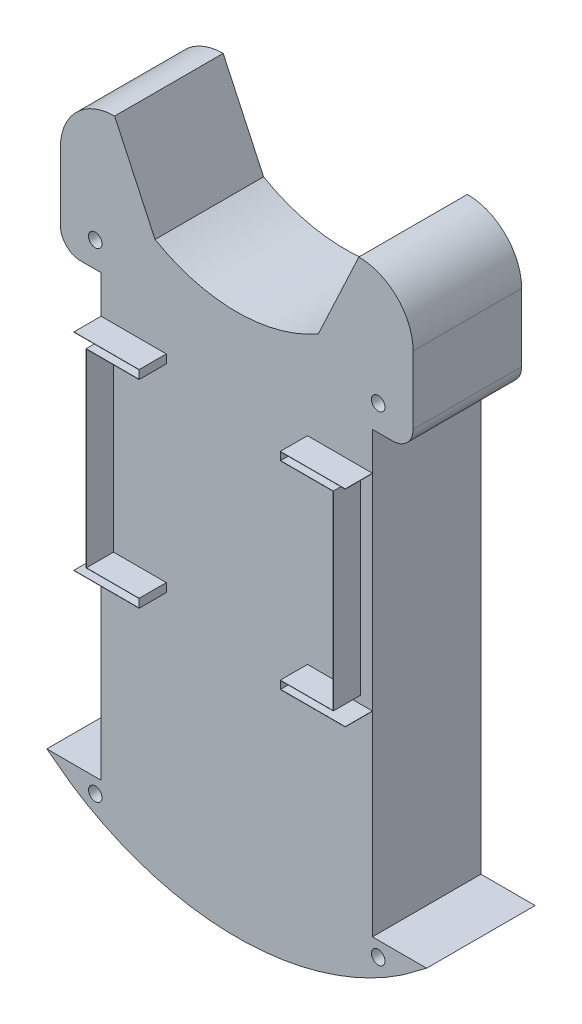
from build123d import *

# Parameters (mm, degrees)
BOSS_EXTRUDE1_DEPTH = 1016
EXTRUDE_THIN1_DEPTH = 254
SKETCH6_R           = 63.5
CUT_EXTRUDE1_DEPTH  = 2032


with BuildPart() as part:
    # Sketch2 → Boss-Extrude1 (new body)
    with BuildSketch(Plane.XY):
        with BuildLine():
            Line((1270, -2155.261469057), (1270, 1959.538530943))
            Line((1270, 1959.538530943), (1460.5, 1959.538530943))
            ThreePointArc((1460.5, 1959.538530943), (1595.203841816, 2015.334689127), (1651, 2150.038530943))
            Line((1651, 2150.038530943), (1651, 2785.038530943))
            ThreePointArc((1651, 2785.038530943), (1502.210244843, 3144.248775786), (1143, 3293.038530943))
            Line((1143, 3293.038530943), (764.60873935, 2481.57585382))
            ThreePointArc((764.60873935, 2481.57585382), (0, 2275.888971296), (-764.60873935, 2481.57585382))
            Line((-764.60873935, 2481.57585382), (-1143, 3293.038530943))
            ThreePointArc((-1143, 3293.038530943), (-1502.210244843, 3144.248775786), (-1651, 2785.038530943))
            Line((-1651, 2785.038530943), (-1651, 2150.038530943))
            ThreePointArc((-1651, 2150.038530943), (-1595.203841816, 2015.334689127), (-1460.5, 1959.538530943))
            Line((-1460.5, 1959.538530943), (-1270, 1959.538530943))
            Line((-1270, 1959.538530943), (-1270, -2155.261469057))
            Line((-1270, -2155.261469057), (-1778, -2155.261469057))
            Line((-1778, -2155.261469057), (-1548.565234395, -2325.592766333))
            ThreePointArc((-1548.565234395, -2325.592766333), (0, -2794), (1548.565234395, -2325.592766333))
            Line((1548.565234395, -2325.592766333), (1778, -2155.261469057))
            Line((1778, -2155.261469057), (1270, -2155.261469057))
        make_face()
    extrude(amount=BOSS_EXTRUDE1_DEPTH)

    # Sketch5 → Extrude-Thin1 (add)
    with BuildSketch(Plane.XY.offset(1016)):
        Polygon((1270, -326.461469057), (662.125525201, -326.461469057), (662.125525201, -250.261469057), (1155.7, -250.261469057), (1155.7, 1527.738530943), (662.125525201, 1527.738530943), (662.125525201, 1603.938530943), (1270, 1603.938530943), (1270, 1601.398530943), (664.665525201, 1601.398530943), (664.665525201, 1530.278530943), (1158.24, 1530.278530943), (1158.24, -252.801469057), (664.665525201, -252.801469057), (664.665525201, -323.921469057), (1270, -323.921469057), align=None)
        Polygon((-1270, -326.461469057), (-662.125525201, -326.461469057), (-662.125525201, -250.261469057), (-1155.7, -250.261469057), (-1155.7, 1527.738530943), (-662.125525201, 1527.738530943), (-662.125525201, 1603.938530943), (-1270, 1603.938530943), (-1270, 1606.478530943), (-659.585525201, 1606.478530943), (-659.585525201, 1525.198530943), (-1153.16, 1525.198530943), (-1153.16, -247.721469057), (-659.585525201, -247.721469057), (-659.585525201, -329.001469057), (-1270, -329.001469057), align=None)
    extrude(amount=EXTRUDE_THIN1_DEPTH)

    # Sketch6 → Cut-Extrude1 (cut)
    with BuildSketch(Plane.XY.offset(1016)):
        with Locations((1324.251050402, 2197.696291545)):
            Circle(SKETCH6_R)
        with Locations((1324.251050402, -2292.872975525)):
            Circle(SKETCH6_R)
        with Locations((-1324.251050402, -2292.872975525)):
            Circle(SKETCH6_R)
        with Locations((-1324.251050402, 2197.696291545)):
            Circle(SKETCH6_R)
    extrude(amount=-CUT_EXTRUDE1_DEPTH, mode=Mode.SUBTRACT)


solid = part.part
